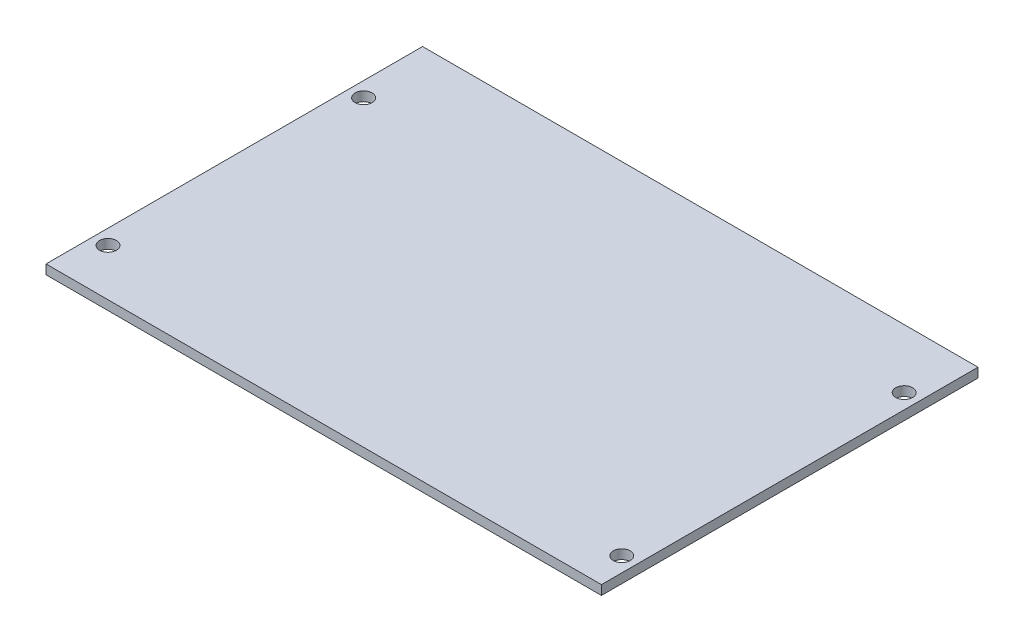
from build123d import *

# Parameters (mm, degrees)
SKETCH1_W      = 177
SKETCH1_H      = 120
SKETCH1_R      = 2.7
EXTRUDE1_DEPTH = 3


with BuildPart() as part:
    # Sketch1 → Extrude1 (new body)
    with BuildSketch(Plane(origin=(0, 0, 0), x_dir=(1, 0, 0), z_dir=(0, 1, 0))):
        Rectangle(SKETCH1_W, SKETCH1_H)
        with Locations(Location((-83.75, 36.454526796, 0), (0, 0, 270))):
            Circle(SKETCH1_R, mode=Mode.SUBTRACT)
        with Locations(Location((83.75, 41.222166987, 0), (0, 0, 270))):
            Circle(SKETCH1_R, mode=Mode.SUBTRACT)
        with Locations(Location((83.75, -48.777833013, 0), (0, 0, 270))):
            Circle(SKETCH1_R, mode=Mode.SUBTRACT)
        with Locations(Location((-83.75, -45, 0), (0, 0, 270))):
            Circle(SKETCH1_R, mode=Mode.SUBTRACT)
    extrude(amount=EXTRUDE1_DEPTH)


solid = part.part
